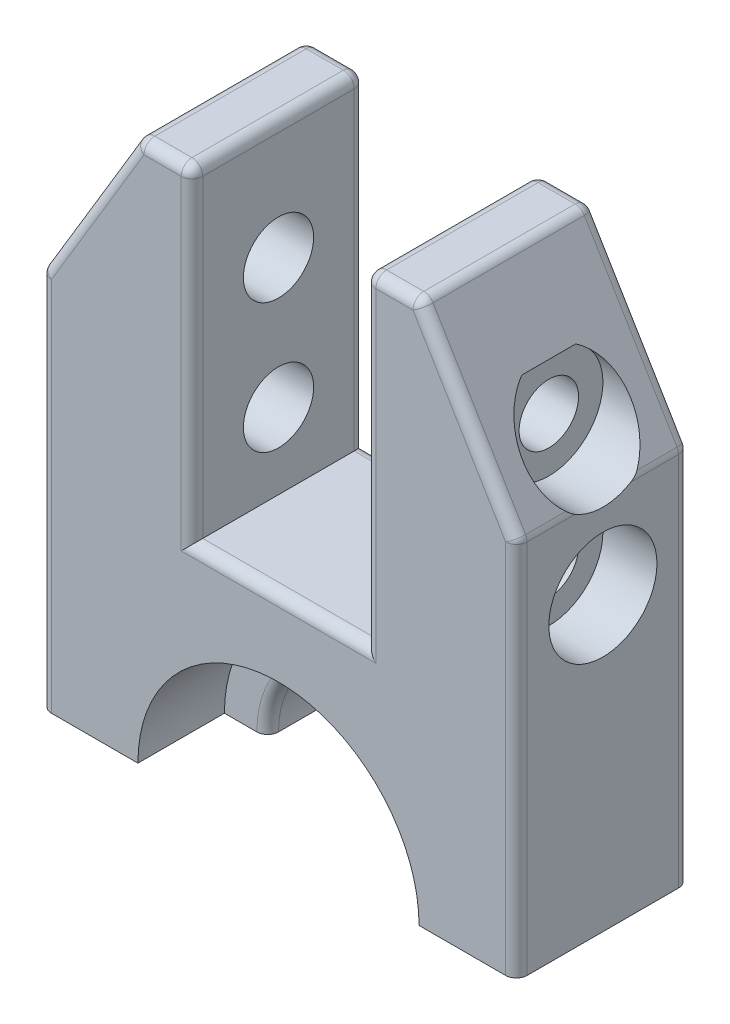
from build123d import *

# Parameters (mm, degrees)
DODANIE_WYCI_GNI_CIE1_DEPTH                       = 8
WYTNIJ_WYCI_GNI_CIE1_DEPTH                        = 8
WYTNIJ_WYCI_GNI_CIE2_DEPTH                        = 39.052595181
WYTNIJ_WYCI_GNI_CIE2_DEPTH_BACK                   = 39.052595181
OTWORY_USTALAJ_CE_5_0MM1_D                        = 5
OTWORY_USTALAJ_CE_5_0MM1_DEPTH                    = 20
OTWORY_USTALAJ_CE_5_0MM1_TIP                      = 1.502151548
SZKIC8_R                                          = 3.15
WYTNIJ_WYCI_GNI_CIE3_DEPTH                        = 10
ZAOKR_GLENIE1_R                                   = 1
POG_BIENIE_WALCOWE_POD_M5_RUB_Z_BEM_W_D           = 5.5
POG_BIENIE_WALCOWE_POD_M5_RUB_Z_BEM_W_DEPTH       = 44
POG_BIENIE_WALCOWE_POD_M5_RUB_Z_BEM_W_CBORE_D     = 10
POG_BIENIE_WALCOWE_POD_M5_RUB_Z_BEM_W_CBORE_DEPTH = 5
POG_BIENIE_WALCOWE_POD_M5_RUB_Z_BEM_W_TIP         = 1.652366702
SZKIC11_R                                         = 3.25
WYTNIJ_WYCI_GNI_CIE4_DEPTH                        = 44.174066359


with BuildPart() as part:
    # Szkic1 → Dodanie-wyciągnięcie1 (new, symmetric)
    with BuildSketch(Plane.XY):
        Polygon((0, 0), (8, 0), (8, 30), (13, 30), (22, 15), (22, -20), (0, -20), align=None)
    dodanie_wyci_gni_cie1 = extrude(amount=DODANIE_WYCI_GNI_CIE1_DEPTH, both=True)

    # Lustro1: Dodanie-wyciągnięcie1 across plane
    add(dodanie_wyci_gni_cie1.mirror(Plane(origin=(0, -20, 8), x_dir=(0, 0, 1), z_dir=(1, 0, 0))))

    # Szkic2 → Wytnij-wyciągnięcie1 (cut)
    with BuildSketch(Plane.XY.offset(8)):
        with BuildLine():
            Line((-13, -20), (13, -20))
            ThreePointArc((13, -20), (0, -7), (-13, -20))
        make_face()
    extrude(amount=-WYTNIJ_WYCI_GNI_CIE1_DEPTH, mode=Mode.SUBTRACT)

    # Szkic3 → Wytnij-wyciągnięcie2 (cut, two sides: drawn at the far end of the back side and taken through both)
    with BuildSketch(Plane.XY.offset(-WYTNIJ_WYCI_GNI_CIE2_DEPTH_BACK)):
        with BuildLine():
            ThreePointArc((9, -20), (0, -11), (-9, -20))
            Line((-9, -20), (9, -20))
        make_face()
    extrude(amount=WYTNIJ_WYCI_GNI_CIE2_DEPTH + WYTNIJ_WYCI_GNI_CIE2_DEPTH_BACK, mode=Mode.SUBTRACT)

    # Otwory ustalające Ø5.0mm1
    with Locations(Plane(origin=(0, -20, 0), x_dir=(-1, 0, 0), z_dir=(0, -1, 0))):
        with Locations((-17.5, 0), (17.5, 0)):
            Hole(OTWORY_USTALAJ_CE_5_0MM1_D / 2, depth=OTWORY_USTALAJ_CE_5_0MM1_DEPTH)
            with Locations((0, 0, -(OTWORY_USTALAJ_CE_5_0MM1_DEPTH + OTWORY_USTALAJ_CE_5_0MM1_TIP / 2))):  # 118° drill point
                Cone(0, OTWORY_USTALAJ_CE_5_0MM1_D / 2, OTWORY_USTALAJ_CE_5_0MM1_TIP, mode=Mode.SUBTRACT)

    # Szkic8 → Wytnij-wyciągnięcie3 (cut)
    with BuildSketch(Plane(origin=(0, -20, 0), x_dir=(-1, 0, 0), z_dir=(0, -1, 0))):
        with Locations(Location((17.5, 0, 0), (0, 0, 180))):
            Circle(SZKIC8_R)
        with Locations(Location((-17.5, 0, 0), (0, 0, 180))):
            Circle(SZKIC8_R)
    extrude(amount=-WYTNIJ_WYCI_GNI_CIE3_DEPTH, mode=Mode.SUBTRACT)

    # Zaokrąglenie1
    zaokr_glenie1_edges = [part.edges().sort_by_distance(p)[0] for p in [
        (8, 30, 0),
        (22, -2.5, 8),
        (13, 30, 0),
        (22, 15, 0),
        (17.5, 22.5, 8),
        (10.5, 30, 8),
        (-8, 15, 8),
        (-10.5, 30, 8),
        (-8, 30, 0),
        (-17.5, 22.5, 8),
        (-13, 30, 0),
        (-22, -2.5, 8),
        (-22, 15, 0),
        (-22, -2.5, -8),
        (8, 15, 8),
        (-17.5, 22.5, -8),
        (-10.5, 30, -8),
        (-8, 15, -8),
        (0, 0, 8),
        (0, -11, 0),
        (0, -11, -8),
        (0, 0, -8),
        (8, 15, -8),
        (10.5, 30, -8),
        (17.5, 22.5, -8),
        (22, -2.5, -8),
    ]]
    fillet(zaokr_glenie1_edges, radius=ZAOKR_GLENIE1_R)

    # Pogłębienie walcowe pod M5 Śrubę z łbem walcowym z gniazdem2
    with Locations(Plane(origin=(22, 156, 204.349537134), x_dir=(0, 0, -1), z_dir=(1, 0, 0))):
        with Locations((204.349537134, -149), (204.349537134, -137)):
            CounterBoreHole(POG_BIENIE_WALCOWE_POD_M5_RUB_Z_BEM_W_D / 2, POG_BIENIE_WALCOWE_POD_M5_RUB_Z_BEM_W_CBORE_D / 2, POG_BIENIE_WALCOWE_POD_M5_RUB_Z_BEM_W_CBORE_DEPTH, depth=POG_BIENIE_WALCOWE_POD_M5_RUB_Z_BEM_W_DEPTH)
            with Locations((0, 0, -(POG_BIENIE_WALCOWE_POD_M5_RUB_Z_BEM_W_DEPTH + POG_BIENIE_WALCOWE_POD_M5_RUB_Z_BEM_W_TIP / 2))):  # 118° drill point
                Cone(0, POG_BIENIE_WALCOWE_POD_M5_RUB_Z_BEM_W_D / 2, POG_BIENIE_WALCOWE_POD_M5_RUB_Z_BEM_W_TIP, mode=Mode.SUBTRACT)

    # Szkic11 → Wytnij-wyciągnięcie4 (cut, through all)
    with BuildSketch(Plane(origin=(-8, 0, 0), x_dir=(0, 0, -1), z_dir=(1, 0, 0))):
        with Locations((0, 7)):
            Circle(SZKIC11_R)
        with Locations((0, 19)):
            Circle(SZKIC11_R)
    extrude(amount=-WYTNIJ_WYCI_GNI_CIE4_DEPTH, mode=Mode.SUBTRACT)


solid = part.part
